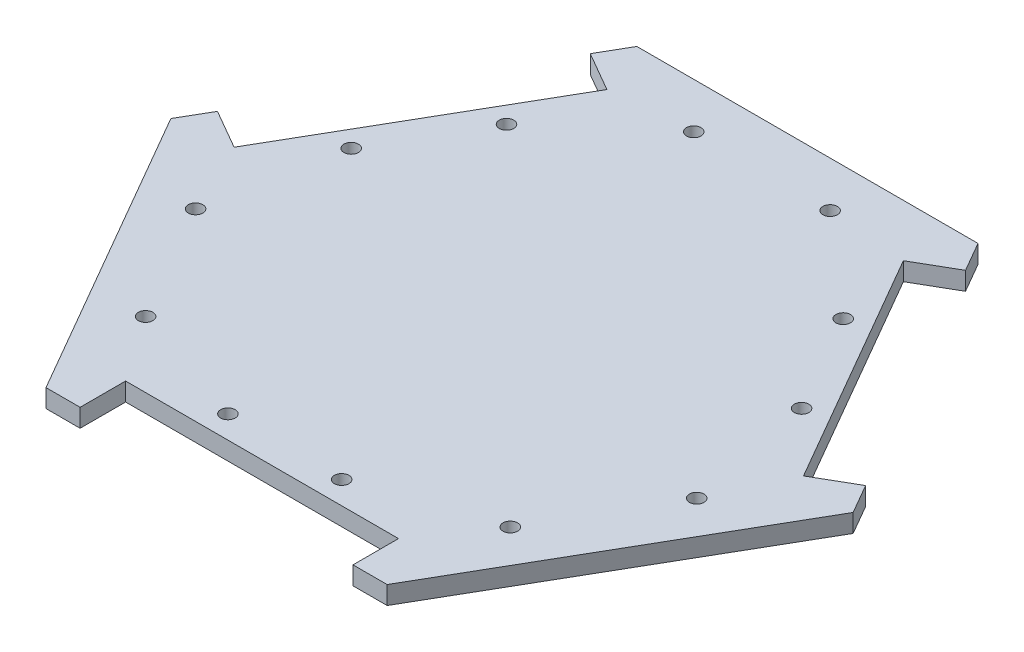
from build123d import *

# Parameters (mm, degrees)
SKETCH1_R           = 2.032
BOSS_EXTRUDE4_DEPTH = 5.08


with BuildPart() as part:
    # Sketch1 → Boss-Extrude4 (new body)
    with BuildSketch(Plane(origin=(0, 0, 0), x_dir=(1, 0, 0), z_dir=(0, 1, 0))):
        Polygon((38.1, -82.48891971), (47.625, -82.48891971), (95.25, 0), (90.4875, 8.248891971), (79.488977372, 1.898891971), (41.388977372, 67.890027739), (52.3875, 74.240027739), (47.625, 82.48891971), (-47.625, 82.48891971), (-52.3875, 74.240027739), (-41.388977372, 67.890027739), (-79.488977372, 1.898891971), (-90.4875, 8.248891971), (-95.25, 0), (-47.625, -82.48891971), (-38.1, -82.48891971), (-38.1, -69.78891971), (38.1, -69.78891971), align=None)
        with Locations(Location((-50.913977372, -51.392243797, 0), (0, 0, 270))):
            Circle(SKETCH1_R, mode=Mode.SUBTRACT)
        with Locations(Location((-15.875, -63.43891971, 0), (0, 0, 270))):
            Circle(SKETCH1_R, mode=Mode.SUBTRACT)
        with Locations(Location((-69.963977372, -18.396675913, 0), (0, 0, 270))):
            Circle(SKETCH1_R, mode=Mode.SUBTRACT)
        with Locations(Location((15.875, -63.43891971, 0), (0, 0, 270))):
            Circle(SKETCH1_R, mode=Mode.SUBTRACT)
        with Locations(Location((50.913977372, -51.392243797, 0), (0, 0, 270))):
            Circle(SKETCH1_R, mode=Mode.SUBTRACT)
        with Locations(Location((69.963977372, -18.396675913, 0), (0, 0, 270))):
            Circle(SKETCH1_R, mode=Mode.SUBTRACT)
        with Locations(Location((-62.877216058, 17.97130657, 0), (0, 0, 270))):
            Circle(SKETCH1_R, mode=Mode.SUBTRACT)
        with Locations(Location((-47.002216058, 45.46761314, 0), (0, 0, 270))):
            Circle(SKETCH1_R, mode=Mode.SUBTRACT)
        with Locations(Location((-19.05, 69.78891971, 0), (0, 0, 270))):
            Circle(SKETCH1_R, mode=Mode.SUBTRACT)
        with Locations(Location((62.877216058, 17.97130657, 0), (0, 0, 270))):
            Circle(SKETCH1_R, mode=Mode.SUBTRACT)
        with Locations(Location((47.002216058, 45.46761314, 0), (0, 0, 270))):
            Circle(SKETCH1_R, mode=Mode.SUBTRACT)
        with Locations(Location((19.05, 69.78891971, 0), (0, 0, 270))):
            Circle(SKETCH1_R, mode=Mode.SUBTRACT)
    extrude(amount=BOSS_EXTRUDE4_DEPTH)


solid = part.part
